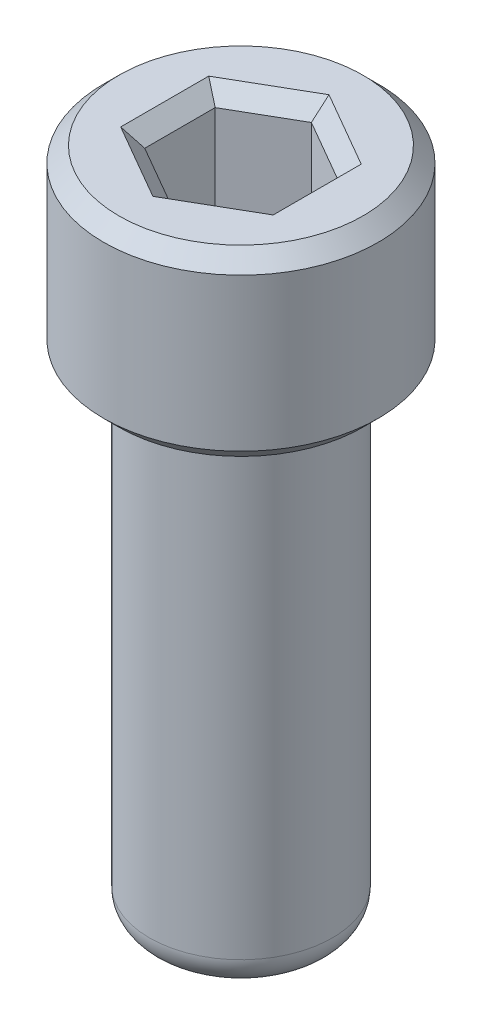
from build123d import *

# Parameters (mm, degrees)
SKETCH1_R           = 1.5
BOSS_EXTRUDE1_DEPTH = 8
SKETCH2_R           = 2.25
BOSS_EXTRUDE2_DEPTH = 3
CUT_EXTRUDE1_DEPTH  = 2
CHAMFER1_SIZE       = 0.25
FILLET1_R           = 0.5


with BuildPart() as part:
    # Sketch1 → Boss-Extrude1 (new body)
    with BuildSketch(Plane(origin=(0, 0, 0), x_dir=(1, 0, 0), z_dir=(0, 1, 0))):
        with Locations(Location((0, 0, 0), (0, 0, 270))):
            Circle(SKETCH1_R)
    extrude(amount=BOSS_EXTRUDE1_DEPTH)

    # Sketch2 → Boss-Extrude2 (add)
    with BuildSketch(Plane(origin=(0, 8, 0), x_dir=(1, 0, 0), z_dir=(0, 1, 0))):
        with Locations(Location((0, 0, 0), (0, 0, 270))):
            Circle(SKETCH2_R)
    extrude(amount=BOSS_EXTRUDE2_DEPTH)

    # Sketch3 → Cut-Extrude1 (cut)
    with BuildSketch(Plane(origin=(0, 11, 0), x_dir=(1, 0, 0), z_dir=(0, 1, 0))):
        Polygon((0, 1.154700538), (-1, 0.577350269), (-1, -0.577350269), (0, -1.154700538), (1, -0.577350269), (1, 0.577350269), align=None)
    extrude(amount=-CUT_EXTRUDE1_DEPTH, mode=Mode.SUBTRACT)

    # Chamfer1
    chamfer1_edges = [part.edges().sort_by_distance(p)[0] for p in [
        (0.5, 11, -0.866025404),
        (-0.5, 11, -0.866025404),
        (-1, 11, 0),
        (-0.5, 11, 0.866025404),
        (0.5, 11, 0.866025404),
        (1, 11, 0),
        (0, 8, -2.25),
        (0, 11, -2.25),
    ]]
    chamfer(chamfer1_edges, length=CHAMFER1_SIZE)

    # Fillet1
    fillet1_edges = [part.edges().sort_by_distance(p)[0] for p in [
        (0, 0, -1.5),
    ]]
    fillet(fillet1_edges, radius=FILLET1_R)


solid = part.part
